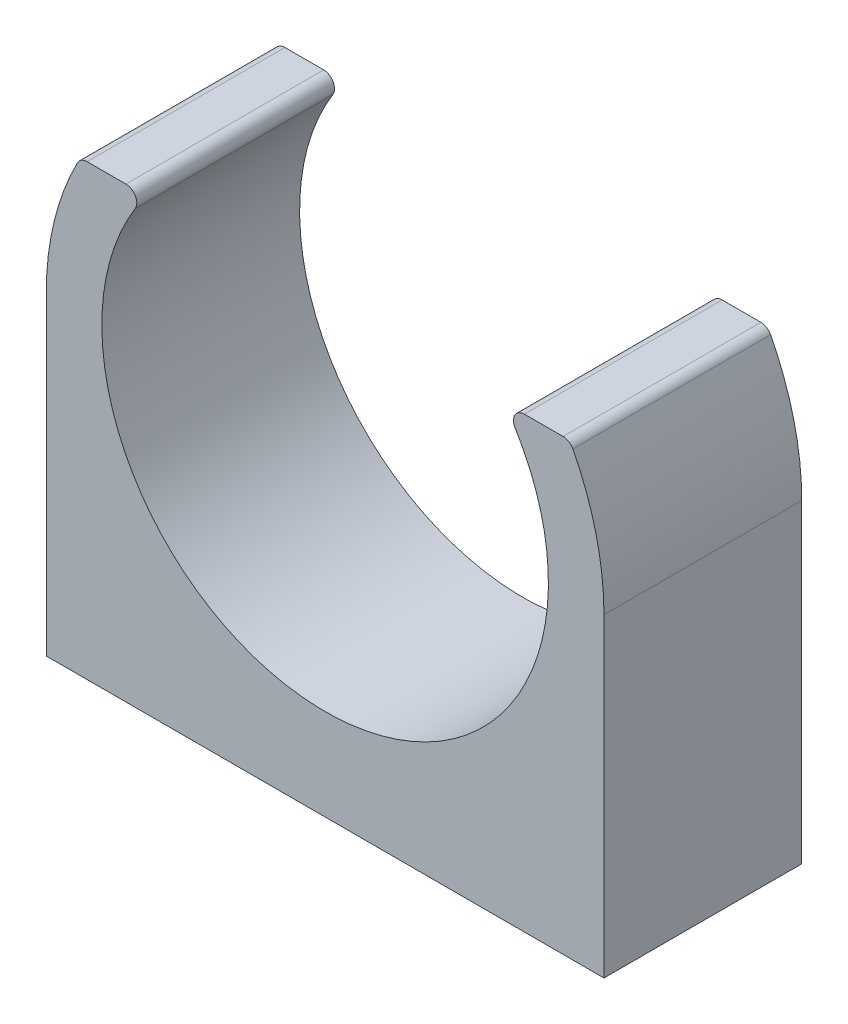
from build123d import *

# Parameters (mm, degrees)
SKETCH1_W           = 42.3
SKETCH1_H           = 3.75
BOSS_EXTRUDE1_DEPTH = 15
FILLET1_R           = 0.8255


with BuildPart() as part:
    # Sketch1 → Boss-Extrude1 (new body)
    with BuildSketch(Plane.XY):
        with BuildLine():
            Line((21.15, 0), (21.15, 20.111200005))
            ThreePointArc((21.15, 20.111200005), (20.489653579, 25.354919699), (18.549849056, 30.271200005))
            Line((18.549849056, 30.271200005), (13.550249835, 30.271200005))
            ThreePointArc((13.550249835, 30.271200005), (0, 3.175), (-13.550249835, 30.271200005))
            Line((-13.550249835, 30.271200005), (-18.549849056, 30.271200005))
            ThreePointArc((-18.549849056, 30.271200005), (-20.489653579, 25.354919699), (-21.15, 20.111200005))
            Line((-21.15, 20.111200005), (-21.15, 0))
            Line((-21.15, 0), (21.15, 0))
        make_face()
        with Locations((0, -1.875)):
            Rectangle(SKETCH1_W, SKETCH1_H)
    extrude(amount=BOSS_EXTRUDE1_DEPTH)

    # Fillet1
    fillet1_edges = [part.edges().sort_by_distance(p)[0] for p in [
        (-18.549849056, 30.271200005, 7.5),
        (-13.550249835, 30.271200005, 7.5),
        (13.550249835, 30.271200005, 7.5),
        (18.549849056, 30.271200005, 7.5),
    ]]
    fillet(fillet1_edges, radius=FILLET1_R)


solid = part.part
